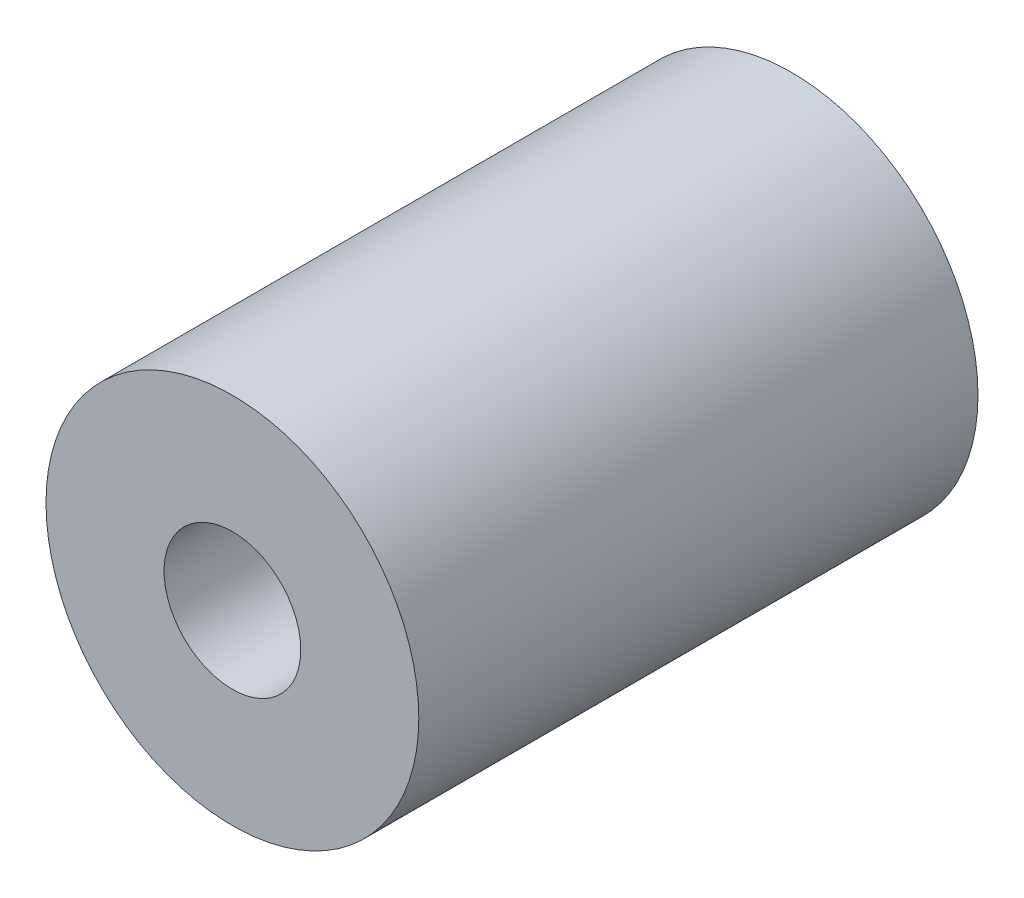
from build123d import *

# Parameters (mm, degrees)
SKETCH1_R           = 3.81
SKETCH1_R_2         = 1.397
BOSS_EXTRUDE1_DEPTH = 11.43


with BuildPart() as part:
    # Sketch1 → Boss-Extrude1 (new body)
    with BuildSketch(Plane.XY):
        Circle(SKETCH1_R)
        Circle(SKETCH1_R_2, mode=Mode.SUBTRACT)
    extrude(amount=BOSS_EXTRUDE1_DEPTH)


solid = part.part
